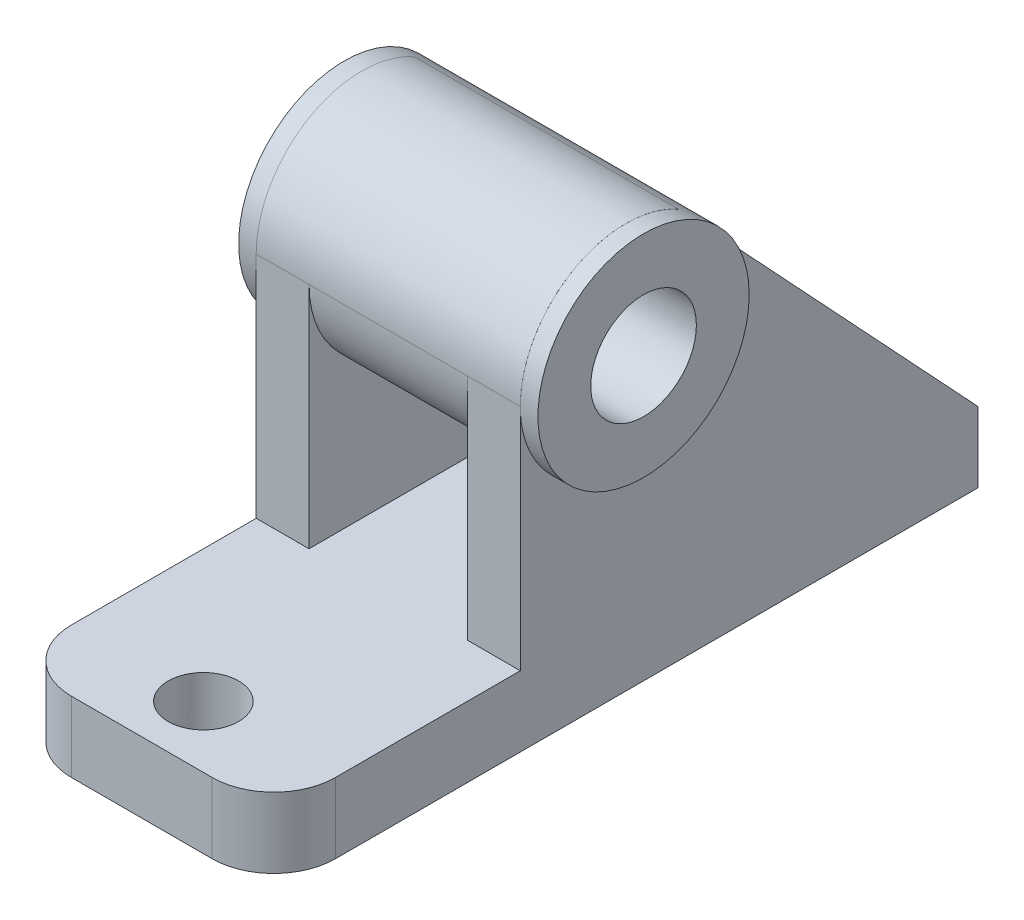
from build123d import *

# Parameters (mm, degrees)
SKETCH1_W           = 80
SKETCH1_H           = 8
BOSS_EXTRUDE1_DEPTH = 30
FILLET1_R           = 7
FILLET2_R           = 7
BOSS_EXTRUDE3_DEPTH = 30
SKETCH4_W           = 18
SKETCH4_H           = 26
CUT_EXTRUDE1_DEPTH  = 26
SKETCH5_R           = 12
BOSS_EXTRUDE4_DEPTH = 32
BOSS_EXTRUDE5_START = 2
SKETCH6_R           = 12
BOSS_EXTRUDE5_DEPTH = 2
CUT_EXTRUDE2_REACH  = 76.983
SKETCH7_R           = 6
CUT_EXTRUDE3_REACH  = 69.701
SKETCH8_R           = 4


with BuildPart() as part:
    # Sketch1 → Boss-Extrude1 (new body)
    with BuildSketch(Plane(origin=(0, 0, 0), x_dir=(0, 0, -1), z_dir=(1, 0, 0))):
        with Locations((-5.989847716, 6.487309645)):
            Rectangle(SKETCH1_W, SKETCH1_H)
    extrude(amount=-BOSS_EXTRUDE1_DEPTH)

    # Fillet1
    fillet1_edges = [part.edges().sort_by_distance(p)[0] for p in [
        (0, 6.487309645, 45.989847716),
    ]]
    fillet(fillet1_edges, radius=FILLET1_R)

    # Fillet2
    fillet2_edges = [part.edges().sort_by_distance(p)[0] for p in [
        (-30, 6.487309645, 45.989847716),
    ]]
    fillet(fillet2_edges, radius=FILLET2_R)

    # Sketch2 → Boss-Extrude3 (add)
    with BuildSketch(Plane(origin=(0, 0, 0), x_dir=(0, 0, -1), z_dir=(1, 0, 0))):
        with BuildLine():
            Line((-17.989847716, 10.487309645), (-17.989847716, 36.487309645))
            ThreePointArc((-17.989847716, 36.487309645), (-11.995980002, 46.878521813), (0, 46.892814939))
            Line((0, 46.892814939), (34.010152284, 10.487309645))
            Line((34.010152284, 10.487309645), (-17.989847716, 10.487309645))
        make_face()
    extrude(amount=-BOSS_EXTRUDE3_DEPTH)

    # Sketch4 → Cut-Extrude1 (cut)
    with BuildSketch(Plane.XY.offset(17.989847716)):
        with Locations((-15, 23.487309645)):
            Rectangle(SKETCH4_W, SKETCH4_H)
    extrude(amount=-CUT_EXTRUDE1_DEPTH, mode=Mode.SUBTRACT)

    # Sketch5 → Boss-Extrude4 (add)
    with BuildSketch(Plane(origin=(0, 0, 0), x_dir=(0, 0, -1), z_dir=(1, 0, 0))):
        with Locations((-5.985600429, 36.487309645)):
            Circle(SKETCH5_R)
    extrude(amount=-BOSS_EXTRUDE4_DEPTH)

    # Sketch6 → Boss-Extrude5 (add)
    with BuildSketch(Plane(origin=(0, 0, 0), x_dir=(0, 0, -1), z_dir=(1, 0, 0)).offset(BOSS_EXTRUDE5_START)):
        with Locations((-5.985600429, 36.487309645)):
            Circle(SKETCH6_R)
    extrude(amount=-BOSS_EXTRUDE5_DEPTH)

    # Sketch7 → Cut-Extrude2 (cut, up to next)
    with BuildSketch(Plane(origin=(2, 0, 0), x_dir=(0, 0, -1), z_dir=(1, 0, 0)), mode=Mode.PRIVATE) as cut_extrude2_sk1:
        with Locations((-5.985600429, 36.487309645)):
            Circle(SKETCH7_R)
    cut_extrude2_tool1 = extrude(cut_extrude2_sk1.sketch, amount=-CUT_EXTRUDE2_REACH, mode=Mode.PRIVATE) & part.part
    add(cut_extrude2_tool1.solids().sort_by_distance((2, 36.48731, 5.9856))[0], mode=Mode.SUBTRACT)

    # Sketch8 → Cut-Extrude3 (cut, up to next)
    with BuildSketch(Plane(origin=(0, 10.487309645, 0), x_dir=(1, 0, 0), z_dir=(0, 1, 0)), mode=Mode.PRIVATE) as cut_extrude3_sk1:
        with Locations(Location((-15, -38.989847716, 0), (0, 0, 270))):
            Circle(SKETCH8_R)
    cut_extrude3_tool1 = extrude(cut_extrude3_sk1.sketch, amount=-CUT_EXTRUDE3_REACH, mode=Mode.PRIVATE) & part.part
    add(cut_extrude3_tool1.solids().sort_by_distance((-15, 10.48731, 38.989848))[0], mode=Mode.SUBTRACT)


solid = part.part
